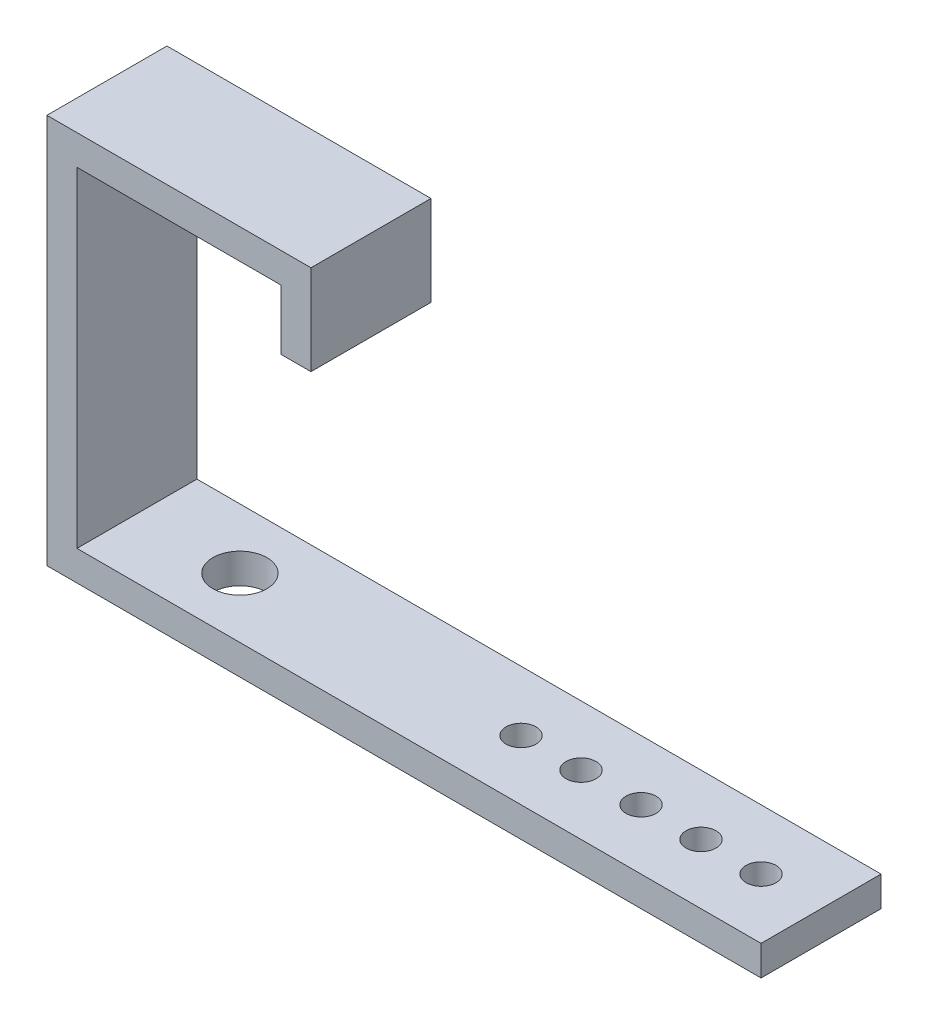
from build123d import *

# Parameters (mm, degrees)
ESQUISSE1_W             = 34
ESQUISSE1_H             = 5
BOSS_EXTRU_1_DEPTH      = 20
ESQUISSE2_R             = 4.5
ENL_V_MAT_EXTRU_1_DEPTH = 5
ESQUISSE5_W             = 20
ESQUISSE5_H             = 5
BOSS_EXTRU_2_DEPTH      = 80
ESQUISSE6_R             = 2.5
ENL_V_MAT_EXTRU_2_DEPTH = 5


with BuildPart() as part:
    # Esquisse1 → Boss.-Extru.1 (new body)
    with BuildSketch(Plane.XY):
        Polygon((-21.374377126, 20.152588272), (-21.374377126, 25.152588272), (-26.374377126, 25.152588272), (-26.374377126, -34.847411728), (-21.374377126, -34.847411728), align=None)
        with Locations((-4.374377126, 22.652588272)):
            Rectangle(ESQUISSE1_W, ESQUISSE1_H)
        Polygon((17.625622874, 25.152588272), (12.625622874, 25.152588272), (12.625622874, 20.152588272), (12.625622874, 10.152588272), (17.625622874, 10.152588272), align=None)
        Polygon((12.625622874, -34.847411728), (-21.374377126, -34.847411728), (-26.374377126, -34.847411728), (-26.374377126, -39.847411728), (12.625622874, -39.847411728), align=None)
    extrude(amount=BOSS_EXTRU_1_DEPTH)

    # Esquisse2 → Enlèv. mat.-Extru.1 (cut)
    with BuildSketch(Plane.XZ.offset(39.847411728)):
        with Locations((-4.219859272, 10)):
            Circle(ESQUISSE2_R)
    extrude(amount=-ENL_V_MAT_EXTRU_1_DEPTH, mode=Mode.SUBTRACT)

    # Esquisse5 → Boss.-Extru.2 (add)
    with BuildSketch(Plane(origin=(12.625622874, 0, 0), x_dir=(0, 0, -1), z_dir=(1, 0, 0))):
        with Locations((-10, -37.347411728)):
            Rectangle(ESQUISSE5_W, ESQUISSE5_H)
    extrude(amount=BOSS_EXTRU_2_DEPTH)

    # Esquisse6 → Enlèv. mat.-Extru.2 (cut)
    with BuildSketch(Plane.XZ.offset(39.847411728)):
        with Locations((82.625622874, 10)):
            Circle(ESQUISSE6_R)
        with Locations((72.625622874, 10)):
            Circle(ESQUISSE6_R)
        with Locations((62.625622874, 10)):
            Circle(ESQUISSE6_R)
        with Locations((52.625622874, 10)):
            Circle(ESQUISSE6_R)
        with Locations((42.625622874, 10)):
            Circle(ESQUISSE6_R)
    extrude(amount=-ENL_V_MAT_EXTRU_2_DEPTH, mode=Mode.SUBTRACT)


solid = part.part
